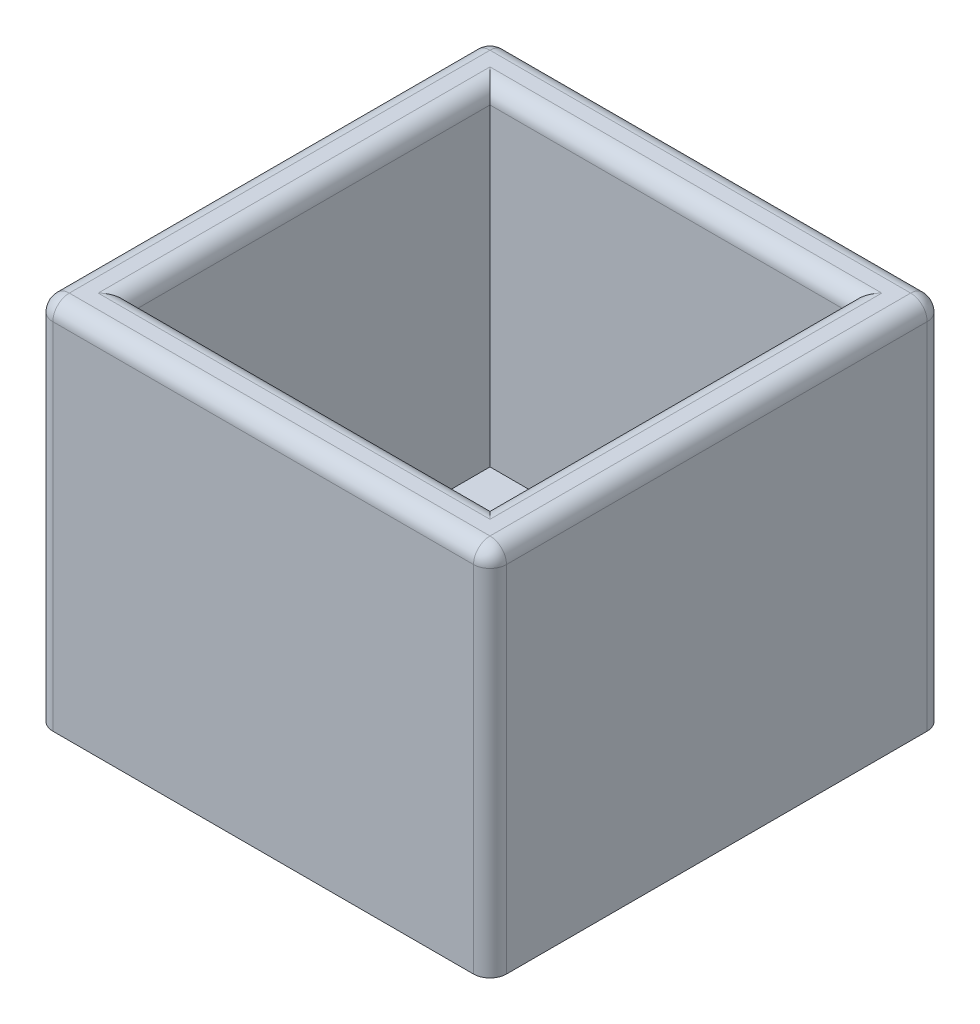
from build123d import *

# Parameters (mm, degrees)
SKETCH1_W           = 55
SKETCH1_H           = 45
BOSS_EXTRUDE1_DEPTH = 55
SKETCH2_W           = 43.5
SKETCH2_H           = 43.5
CUT_EXTRUDE1_DEPTH  = 40
FILLET2_R           = 2


with BuildPart() as part:
    # Sketch1 → Boss-Extrude1 (new body)
    with BuildSketch(Plane.XY):
        Rectangle(SKETCH1_W, SKETCH1_H)
    extrude(amount=BOSS_EXTRUDE1_DEPTH)

    # Sketch2 → Cut-Extrude1 (cut)
    with BuildSketch(Plane(origin=(0, 22.5, 0), x_dir=(1, 0, 0), z_dir=(0, 1, 0))):
        with Locations((0, -27.5)):
            Rectangle(SKETCH2_W, SKETCH2_H)
    extrude(amount=-CUT_EXTRUDE1_DEPTH, mode=Mode.SUBTRACT)

    # Fillet2
    fillet2_edges = [part.edges().sort_by_distance(p)[0] for p in [
        (-27.5, 0, 55),
        (21.75, 22.5, 27.5),
        (0, 22.5, 5.75),
        (-21.75, 22.5, 27.5),
        (0, 22.5, 49.25),
        (27.5, 0, 55),
        (-27.5, 0, 0),
        (0, 22.5, 0),
        (27.5, 0, 0),
        (0, 22.5, 55),
        (-27.5, 22.5, 27.5),
        (27.5, 22.5, 27.5),
    ]]
    fillet(fillet2_edges, radius=FILLET2_R)


solid = part.part
